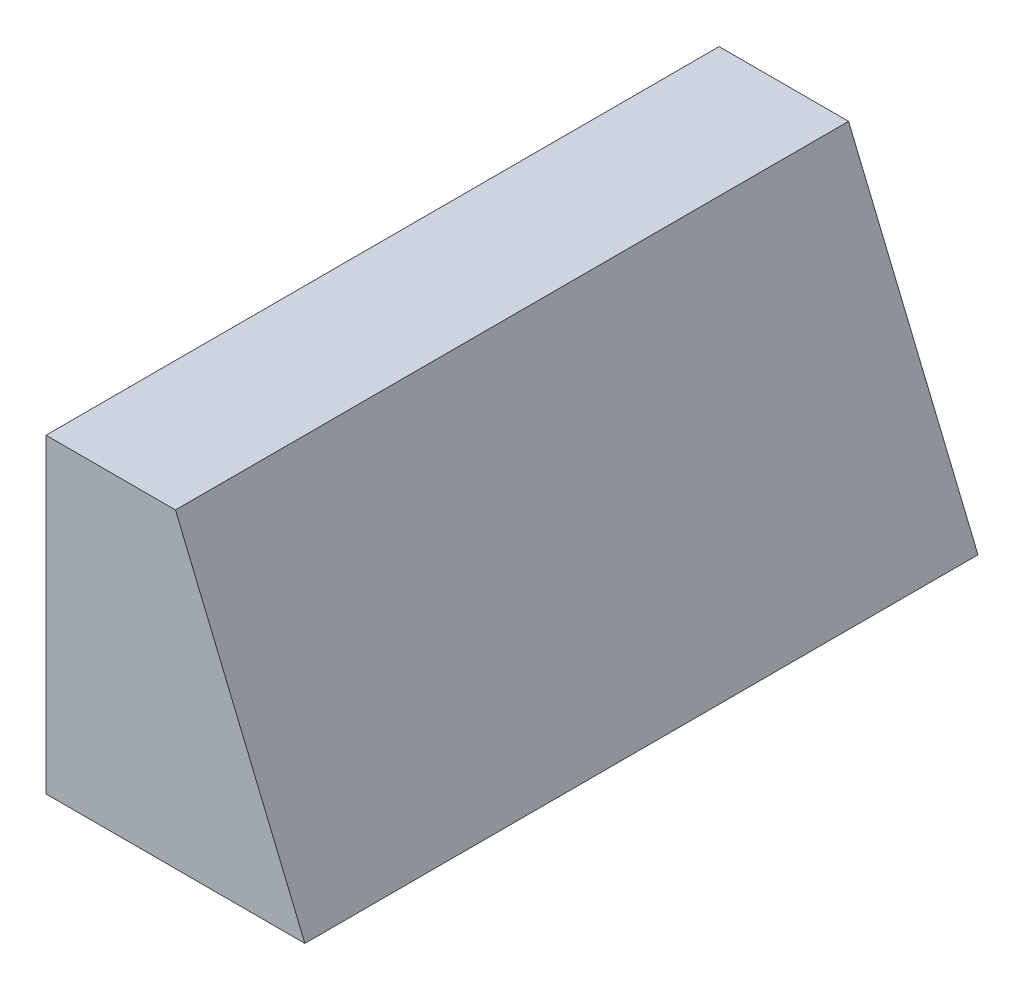
from build123d import *

# Parameters (mm, degrees)
BOSS_EXTRUDE1_DEPTH = 26


with BuildPart() as part:
    # Sketch1 → Boss-Extrude1 (new body)
    with BuildSketch(Plane.XY):
        Polygon((-5.385159011, 5.406360424), (-5.385159011, -6.593639576), (4.614840989, -6.593639576), (-0.385159011, 5.406360424), align=None)
    extrude(amount=BOSS_EXTRUDE1_DEPTH)


solid = part.part
